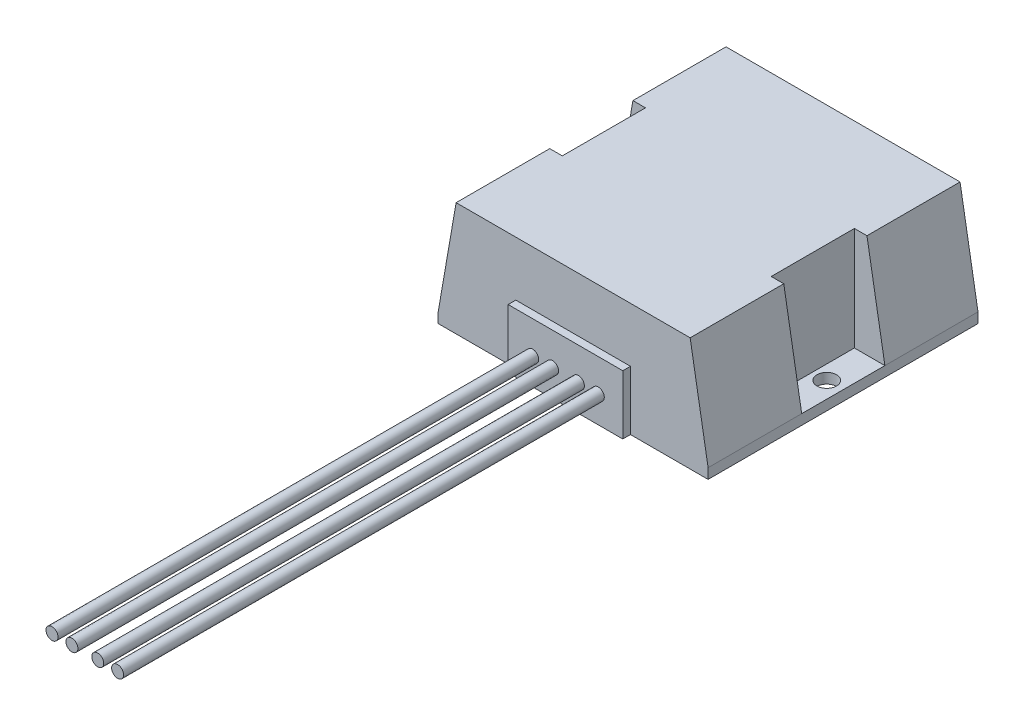
from build123d import *

# Parameters (mm, degrees)
BOSS_EXTRUDE1_DEPTH   = 37.084
CUT_EXTRUDE1_START    = 2.794
SKETCH2_W             = 8.382
SKETCH2_H             = 22.86
CUT_EXTRUDE1_DEPTH    = 28.448
SKETCH4_R             = 2.6924
CUT_EXTRUDE2_DEPTH    = 60.663513272
BOSS_EXTRUDE2_DEPTH   = 2.1082
SKETCH6_R             = 1.651
BOSS_EXTRUDE3_DEPTH   = 132.08
BOSS_EXTRUDE3_2_DEPTH = 132.08


with BuildPart() as part:
    # Sketch1 → Boss-Extrude1 (new, symmetric)
    with BuildSketch(Plane.XY):
        Polygon((0, 0), (37.084, 0), (37.084, 2.794), (32.1564, 31.242), (0, 31.242), (-32.1564, 31.242), (-37.084, 2.794), (-37.084, 0), align=None)
    extrude(amount=BOSS_EXTRUDE1_DEPTH, both=True)

    # Sketch2 → Cut-Extrude1 (cut)
    with BuildSketch(Plane(origin=(0, 0, 0), x_dir=(1, 0, 0), z_dir=(0, 1, 0)).offset(CUT_EXTRUDE1_START)):
        with Locations((32.893, 0.068462688)):
            Rectangle(SKETCH2_W, SKETCH2_H)
    cut_extrude1 = extrude(amount=CUT_EXTRUDE1_DEPTH, mode=Mode.SUBTRACT)

    # Sketch4 → Cut-Extrude2 (cut, through all)
    with BuildSketch(Plane(origin=(0, 2.794, 0), x_dir=(1, 0, 0), z_dir=(0, 1, 0))):
        with Locations(Location((32.614124272, 0, 0), (0, 0, 270))):
            Circle(SKETCH4_R)
    cut_extrude2 = extrude(amount=-CUT_EXTRUDE2_DEPTH, mode=Mode.SUBTRACT)

    # Mirror1: Cut-Extrude2 across plane
    add(cut_extrude2.mirror(Plane(origin=(0, 0, 0), x_dir=(0, 0, 1), z_dir=(1, 0, 0))), mode=Mode.SUBTRACT)

    # Mirror2: Cut-Extrude1 across plane
    add(cut_extrude1.mirror(Plane(origin=(0, 0, 0), x_dir=(0, 0, 1), z_dir=(1, 0, 0))), mode=Mode.SUBTRACT)

    # Sketch5 → Boss-Extrude2 (add)
    with BuildSketch(Plane.XY.offset(37.084)):
        Polygon((0, 0), (15.748, 0), (15.748, 16.256), (-15.748, 16.256), (-15.748, 0), align=None)
    extrude(amount=BOSS_EXTRUDE2_DEPTH)


with BuildPart() as body_2:
    # Sketch6 → Boss-Extrude3 (new body)
    with BuildSketch(Plane.XY.offset(39.1922)):
        with Locations((-3.556, 7.366)):
            Circle(SKETCH6_R)
    boss_extrude3 = extrude(amount=BOSS_EXTRUDE3_DEPTH)


with BuildPart() as body_3:
    # Sketch6 → Boss-Extrude3 2 (new body)
    with BuildSketch(Plane.XY.offset(39.1922)):
        with Locations((-9.017, 7.366)):
            Circle(SKETCH6_R)
    boss_extrude3_2 = extrude(amount=BOSS_EXTRUDE3_2_DEPTH)


with BuildPart() as part_1:
    add(part.part)

    # Mirror5: Boss-Extrude3, Boss-Extrude3 2 across plane
    add(boss_extrude3.mirror(Plane(origin=(0, 0, 0), x_dir=(0, 0, 1), z_dir=(1, 0, 0))))
    add(boss_extrude3_2.mirror(Plane(origin=(0, 0, 0), x_dir=(0, 0, 1), z_dir=(1, 0, 0))))


solid = Compound([body_2.part, body_3.part, part_1.part])
